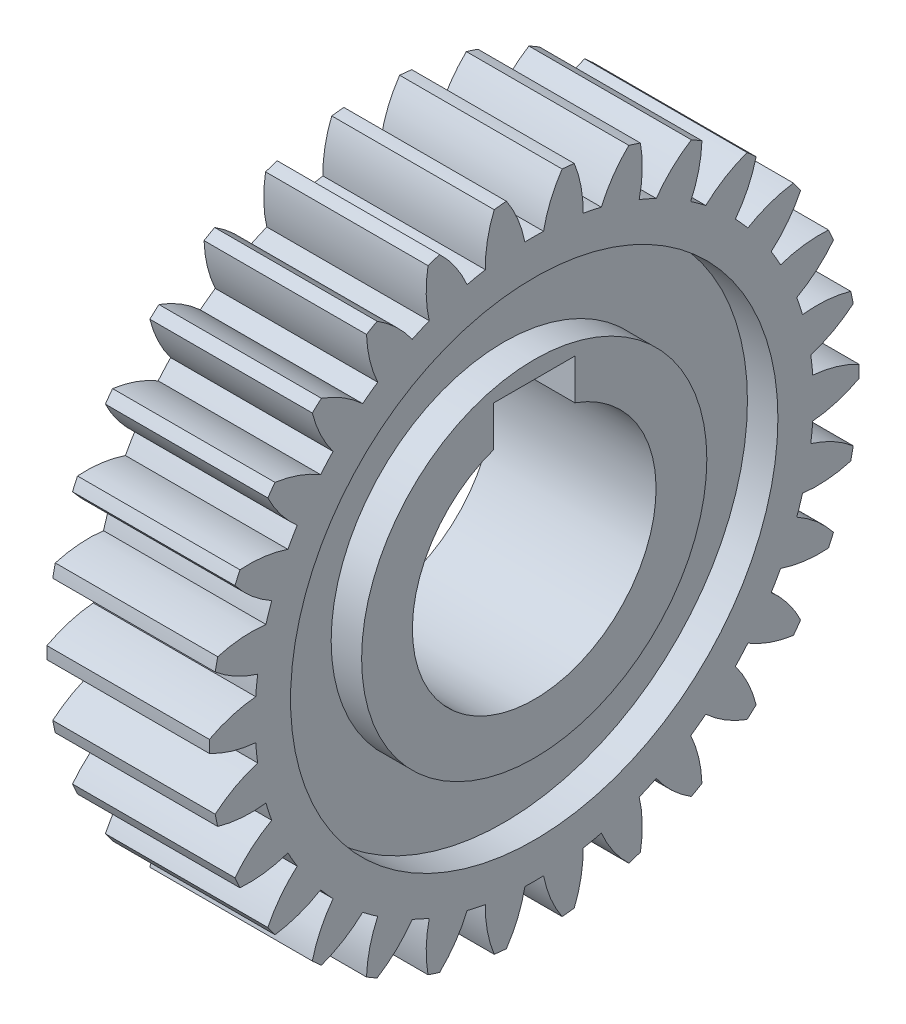
from build123d import *

# Parameters (mm, degrees)
BASPROSKE_W              = 16
BASPROSKE_H              = 32
TOOTHCUT_DEPTH           = 49
TEETHCUTS_COUNT          = 30
TEETHCUTS_ANGLE          = 348
BORSKE_R                 = 12
BORE_DEPTH               = 50.0000508
SCHIZZO1_R               = 24
SCHIZZO1_R_2             = 17
TAGLIO_ESTRUSIONE1_DEPTH = 3
TAGLIO_ESTRUSIONE2_DEPTH = 48.921417629


with BuildPart() as part:
    # BasProSke → Base-Revolve (revolve)
    with BuildSketch(Plane(origin=(0, 0, 0), x_dir=(1, 0, 0), z_dir=(0, 1, 0)), mode=Mode.PRIVATE) as base_revolve_sk:
        with Locations((8, 16)):
            Rectangle(BASPROSKE_W, BASPROSKE_H)
    revolve(base_revolve_sk.sketch.rotate(Axis((-10, 0, 0), (1, 0, 0)), 180), axis=Axis((-10, 0, 0), (1, 0, 0)))

    # TooCutSke → ToothCut (cut, through all)
    with BuildSketch(Plane(origin=(0, 0, 0), x_dir=(0, 0, -1), z_dir=(1, 0, 0))):
        with BuildLine():
            ThreePointArc((0.918551563, 27.483654488), (0, 27.499), (-0.918551563, 27.483654488))
            ThreePointArc((-0.918551563, 27.483654488), (-1.617208176, 29.787801627), (-2.761784709, 31.906093311))
            ThreePointArc((-2.761784709, 31.906093311), (0, 32.0254), (2.761784709, 31.906093311))
            ThreePointArc((2.761784709, 31.906093311), (1.617208176, 29.787801627), (0.918551563, 27.483654488))
        make_face()
    toothcut = extrude(amount=TOOTHCUT_DEPTH, mode=Mode.SUBTRACT)

    # TeethCuts: ToothCut ×30 about axis
    teethcuts_axis = Axis((-10, 0, 0), (1, 0, 0))
    for i in range(1, TEETHCUTS_COUNT):
        add(toothcut.rotate(teethcuts_axis, i * TEETHCUTS_ANGLE / (TEETHCUTS_COUNT - 1)), mode=Mode.SUBTRACT)

    # BorSke → Bore (cut, symmetric)
    with BuildSketch(Plane(origin=(0, 0, 0), x_dir=(0, 0, -1), z_dir=(1, 0, 0))):
        with Locations(Location((0, 0, 0), (0, 0, 180))):
            Circle(BORSKE_R)
    extrude(amount=BORE_DEPTH, both=True, mode=Mode.SUBTRACT)

    # Schizzo1 → Taglio-Estrusione1 (cut)
    with BuildSketch(Plane(origin=(16, 0, 0), x_dir=(0, 0, -1), z_dir=(1, 0, 0))):
        Circle(SCHIZZO1_R)
        Circle(SCHIZZO1_R_2, mode=Mode.SUBTRACT)
    taglio_estrusione1 = extrude(amount=-TAGLIO_ESTRUSIONE1_DEPTH, mode=Mode.SUBTRACT)

    # Specchia1: Taglio-Estrusione1 across plane
    add(taglio_estrusione1.mirror(Plane(origin=(8, 0, 0), x_dir=(0, 0, 1), z_dir=(1, 0, 0))), mode=Mode.SUBTRACT)

    # Schizzo2 → Taglio-Estrusione2 (cut, through all)
    with BuildSketch(Plane(origin=(16, 0, 0), x_dir=(0, 0, -1), z_dir=(1, 0, 0))):
        with BuildLine():
            Line((4, 15.3), (-4, 15.3))
            Line((-4, 15.3), (-4, 11.313708499))
            ThreePointArc((-4, 11.313708499), (0, 12), (4, 11.313708499))
            Line((4, 11.313708499), (4, 15.3))
        make_face()
    extrude(amount=-TAGLIO_ESTRUSIONE2_DEPTH, mode=Mode.SUBTRACT)


solid = part.part
